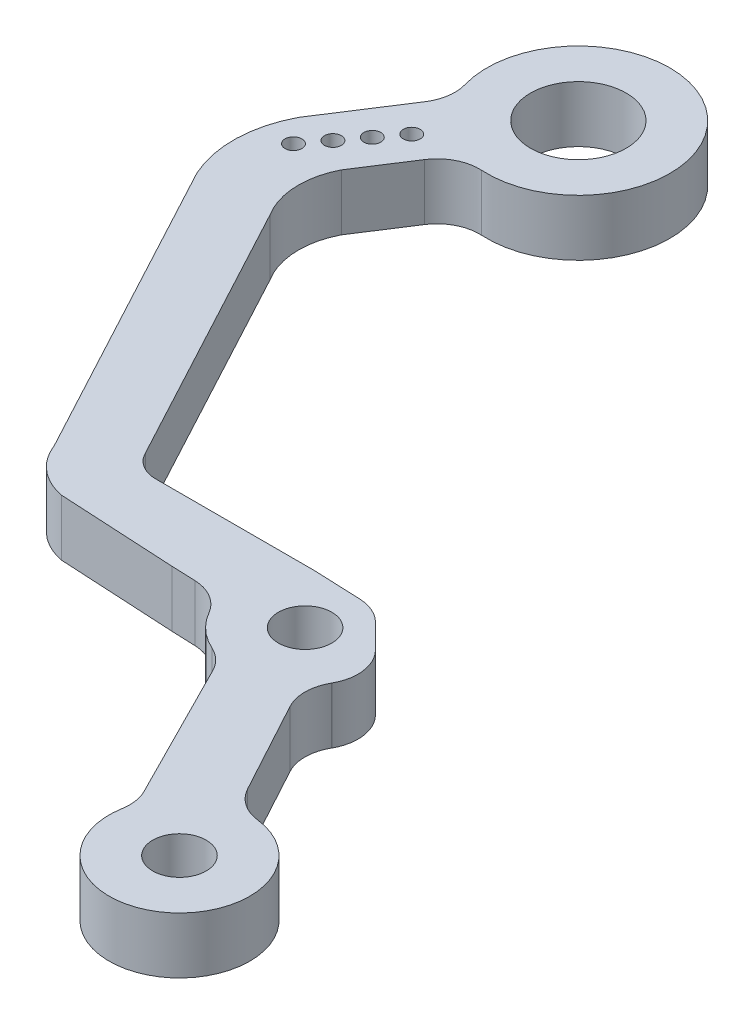
from build123d import *

# Parameters (mm, degrees)
SKETCH2_R           = 1.9
SKETCH2_R_2         = 3.4
BOSS_EXTRUDE1_DEPTH = 4
SKETCH3_R           = 0.6
CUT_EXTRUDE1_DEPTH  = 6
FILLET1_R           = 3


with BuildPart() as part:
    # Sketch2 → Boss-Extrude1 (new body)
    with BuildSketch(Plane(origin=(0, 0, 0), x_dir=(1, 0, 0), z_dir=(0, 1, 0))):
        with BuildLine():
            ThreePointArc((49.0624911, 100.728722197), (55.253975507, 111.876765002), (45.278809785, 103.932622106))
            Line((45.278809785, 103.932622106), (41.677103445, 98.359455452))
            Line((41.677103445, 98.359455452), (40.917682236, 97.184351056))
            ThreePointArc((40.917682236, 97.184351056), (40.000914232, 93.684113367), (40.729811239, 90.139986308))
            Line((40.729811239, 90.139986308), (51.995593872, 69.121735128))
            Line((51.995593872, 69.121735128), (52.448751423, 68.276291936))
            ThreePointArc((52.448751423, 68.276291936), (53.733769558, 66.46917356), (55.737555004, 65.519546097))
            Line((55.737555004, 65.519546097), (56.575581952, 65.474059755))
            Line((56.575581952, 65.474059755), (56.904280571, 65.456218685))
            Line((56.904280571, 65.456218685), (64.043852088, 65.068697747))
            Line((64.043852088, 65.068697747), (67.659658755, 64.927019071))
            ThreePointArc((67.659658755, 64.927019071), (68.973857559, 62.514332624), (71.364365032, 61.16020988))
            Line((71.364365032, 61.16020988), (77.3922419, 49.235496946))
            ThreePointArc((77.3922419, 49.235496946), (85.295038859, 43.696471142), (81.278467798, 52.471558808))
            Line((81.278467798, 52.471558808), (75.926202221, 62.342787356))
            ThreePointArc((75.926202221, 62.342787356), (77.117833046, 64.012589982), (77.538655529, 66.020358214))
            Line((77.538655529, 66.020358214), (73.882441794, 69.676571949))
            Line((73.882441794, 69.676571949), (69.341583584, 69.864669723))
            Line((69.341583584, 69.864669723), (65.404712603, 69.864669723))
            Line((65.404712603, 69.864669723), (58.04793187, 69.864669723))
            ThreePointArc((58.04793187, 69.864669723), (56.992330015, 70.157110244), (56.212176606, 70.925990854))
            ThreePointArc((56.212176606, 70.925990854), (56.161986001, 71.014595828), (56.115987655, 71.105447853))
            Line((56.115987655, 71.105447853), (45.913475043, 90.139986308))
            ThreePointArc((45.913475043, 90.139986308), (45.708651409, 90.489699119), (45.530826332, 90.853883157))
            ThreePointArc((45.530826332, 90.853883157), (45.074746145, 93.175228741), (45.661998303, 95.466907026))
            Line((45.661998303, 95.466907026), (49.0624911, 100.728722197))
        make_face()
        with Locations(Location((82.095552315, 47.538773298, 0), (0, 0, 270))):
            Circle(SKETCH2_R, mode=Mode.SUBTRACT)
        with Locations(Location((72.538655529, 66.020358214, 0), (0, 0, 270))):
            Circle(SKETCH2_R, mode=Mode.SUBTRACT)
        with Locations(Location((51.053576092, 106.916256485, 0), (0, 0, 270))):
            Circle(SKETCH2_R_2, mode=Mode.SUBTRACT)
    extrude(amount=BOSS_EXTRUDE1_DEPTH)

    # Sketch3 → Cut-Extrude1 (cut)
    with BuildSketch(Plane(origin=(0, 4, 0), x_dir=(1, 0, 0), z_dir=(0, 1, 0))):
        with Locations(Location((42.353398584, 95.378951282, 0), (0, 0, 270))):
            Circle(SKETCH3_R)
        with Locations(Location((43.557575402, 96.975810134, 0), (0, 0, 270))):
            Circle(SKETCH3_R)
        with Locations(Location((44.761752219, 98.572668985, 0), (0, 0, 270))):
            Circle(SKETCH3_R)
        with Locations(Location((45.965929037, 100.169527837, 0), (0, 0, 270))):
            Circle(SKETCH3_R)
    extrude(amount=-CUT_EXTRUDE1_DEPTH, mode=Mode.SUBTRACT)

    # Fillet1
    fillet1_edges = [part.edges().sort_by_distance(p)[0] for p in [
        (71.364365032, 2, -61.16020988),
        (67.659658755, 2, -64.927019071),
        (45.278809785, 2, -103.932622106),
        (49.0624911, 2, -100.728722197),
        (73.882441794, 2, -69.676571949),
        (77.538655529, 2, -66.020358214),
        (75.926202221, 2, -62.342787356),
        (81.278467798, 2, -52.471558808),
        (77.3922419, 2, -49.235496946),
    ]]
    fillet(fillet1_edges, radius=FILLET1_R)


solid = part.part
